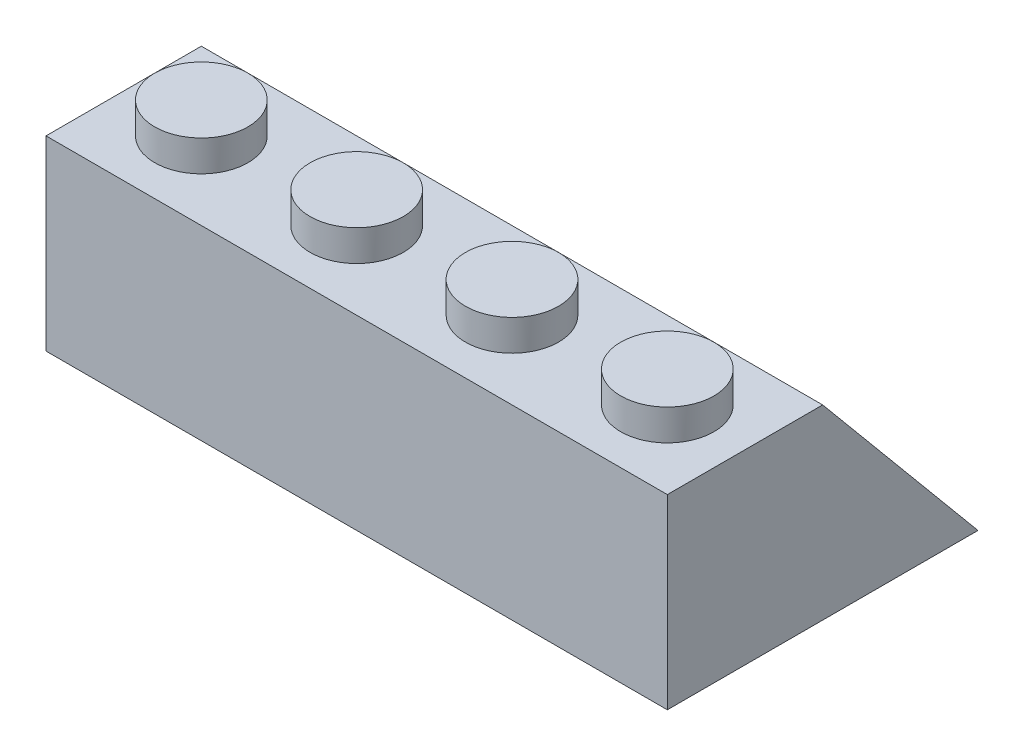
from build123d import *

# Parameters (mm, degrees)
BOSS_EXTRUDE1_DEPTH = 32
SKETCH2_R           = 2.4
BOSS_EXTRUDE2_DEPTH = 1.6
LPATTERN1_COUNT     = 4
LPATTERN1_PITCH     = 8
SHELL1_T            = -1.6


with BuildPart() as part:
    # Sketch1 → Boss-Extrude1 (new body)
    with BuildSketch(Plane(origin=(0, 0, 0), x_dir=(0, 0, -1), z_dir=(1, 0, 0))):
        Polygon((0, 0), (16, 0), (8, 9.6), (0, 9.6), align=None)
    extrude(amount=BOSS_EXTRUDE1_DEPTH)

    # Sketch2 → Boss-Extrude2 (add)
    with BuildSketch(Plane(origin=(0, 9.6, 0), x_dir=(1, 0, 0), z_dir=(0, 1, 0))):
        with Locations(Location((4, 4, 0), (0, 0, 90))):
            Circle(SKETCH2_R)
    boss_extrude2 = extrude(amount=BOSS_EXTRUDE2_DEPTH)

    # LPattern1: Boss-Extrude2 ×4
    with Locations(*[(i * LPATTERN1_PITCH, 0, 0) for i in range(1, LPATTERN1_COUNT)]):
        add(boss_extrude2)

    # Shell1
    shell1_openings = [part.faces().sort_by_distance(p)[0] for p in [
        (16, 0, -8),
    ]]
    offset(amount=SHELL1_T, openings=shell1_openings, kind=Kind.INTERSECTION)


solid = part.part
